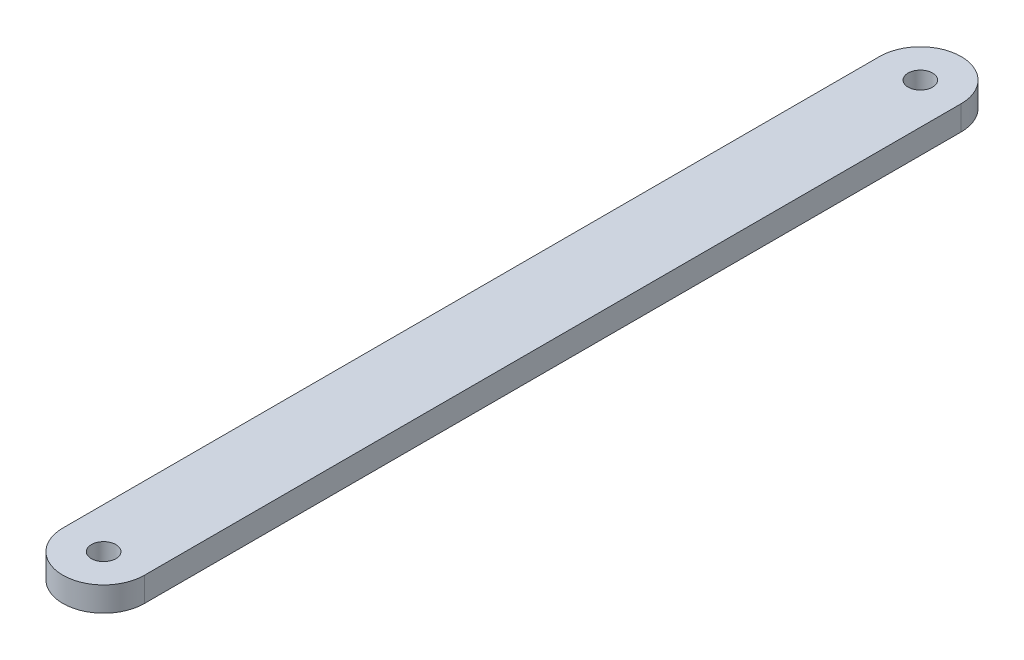
from build123d import *

# Parameters (mm, degrees)
BOSS_EXTRUDE1_DEPTH      = 50
BOSS_EXTRUDE1_DEPTH_BACK = 50
SKETCH2_W                = 10
SKETCH2_H                = 3
SKETCH3_W                = 5
SKETCH3_H                = 3
SKETCH5_R                = 1.5
CUT_EXTRUDE2_DEPTH       = 3


with BuildPart() as part:
    # Sketch2 → Boss-Extrude1 (new, two sides: drawn at the far end of the back side and taken through both)
    with BuildSketch(Plane.XY.offset(-BOSS_EXTRUDE1_DEPTH_BACK)):
        with Locations((-5, -1)):
            Rectangle(SKETCH2_W, SKETCH2_H)
    extrude(amount=BOSS_EXTRUDE1_DEPTH + BOSS_EXTRUDE1_DEPTH_BACK)

    # Sketch3 → Revolve1 (revolve)
    with BuildSketch(Plane.XY.offset(50)):
        with Locations((-2.5, -1)):
            Rectangle(SKETCH3_W, SKETCH3_H)
    revolve1 = revolve(axis=Axis((-5, 0.5, 50), (0, -1, 0)))

    # Mirror1: Revolve1 across plane
    add(revolve1.mirror(Plane.XY))

    # Sketch5 → Cut-Extrude2 (cut)
    with BuildSketch(Plane(origin=(0, -2.5, 0), x_dir=(-1, 0, 0), z_dir=(0, -1, 0))):
        with Locations(Location((5, -50, 0), (0, 0, 180))):
            Circle(SKETCH5_R)
    cut_extrude2 = extrude(amount=-CUT_EXTRUDE2_DEPTH, mode=Mode.SUBTRACT)

    # Mirror2: Cut-Extrude2 across plane
    add(cut_extrude2.mirror(Plane.XY), mode=Mode.SUBTRACT)


solid = part.part
